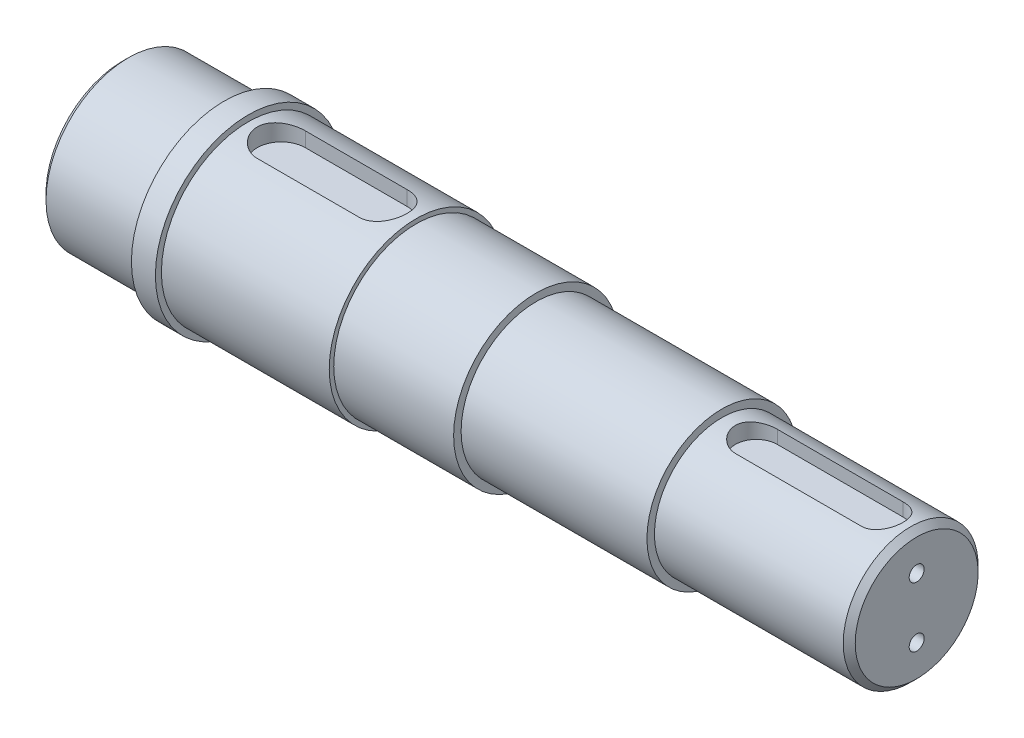
from build123d import *

# Parameters (mm, degrees)
CUT_EXTRUDE_1_DEPTH    = 6
CUT_EXTRUDE_2_DEPTH    = 5.5
CHAMFER_1_SIZE         = 2
HOLE_WIZARD_M6_1_D     = 5
HOLE_WIZARD_M6_1_DEPTH = 17
HOLE_WIZARD_M6_1_TIP   = 1.502151548


with BuildPart() as part:
    # 草图1 → 旋转1 (revolve)
    with BuildSketch(Plane.XY, mode=Mode.PRIVATE) as revolve_1_sk:
        Polygon((-76.99110035, 0), (188.00889965, 0), (188.00889965, 22.5), (123.00889965, 22.5), (123.00889965, 25), (61.00889965, 25), (61.00889965, 27.5), (21.00889965, 27.5), (21.00889965, 29), (-34.99110035, 29), (-34.99110035, 31), (-42.99110035, 31), (-42.99110035, 27.5), (-76.99110035, 27.5), align=None)
    revolve(revolve_1_sk.sketch.rotate(Axis((-104.076979444, 0, 0), (1, 0, 0)), 90), axis=Axis((-104.076979444, 0, 0), (1, 0, 0)))

    # 草图2 → 切除-拉伸1 (cut)
    with BuildSketch(Plane(origin=(0, 29, 0), x_dir=(-1, 0, 0), z_dir=(0, 1, 0))):
        with BuildLine():
            Line((23.99110035, -8), (-10.00889965, -8))
            ThreePointArc((-10.00889965, -8), (-18.00889965, 0), (-10.00889965, 8))
            Line((-10.00889965, 8), (23.99110035, 8))
            ThreePointArc((23.99110035, 8), (31.99110035, 0), (23.99110035, -8))
        make_face()
    extrude(amount=-CUT_EXTRUDE_1_DEPTH, mode=Mode.SUBTRACT)

    # 草图3 → 切除-拉伸2 (cut)
    with BuildSketch(Plane(origin=(0, 22.5, 0), x_dir=(-1, 0, 0), z_dir=(0, 1, 0))):
        with BuildLine():
            Line((-176.50889965, 7), (-134.50889965, 7))
            ThreePointArc((-134.50889965, 7), (-129.559152182, 4.949747468), (-127.50889965, 0))
            ThreePointArc((-127.50889965, 0), (-129.559152182, -4.949747468), (-134.50889965, -7))
            Line((-134.50889965, -7), (-176.50889965, -7))
            ThreePointArc((-176.50889965, -7), (-181.458647118, -4.949747468), (-183.50889965, 0))
            ThreePointArc((-183.50889965, 0), (-181.458647118, 4.949747468), (-176.50889965, 7))
        make_face()
    extrude(amount=-CUT_EXTRUDE_2_DEPTH, mode=Mode.SUBTRACT)

    # 倒角1
    chamfer_1_edges = [part.edges().sort_by_distance(p)[0] for p in [
        (188.00889965, 0, -22.5),
        (-76.99110035, 0, -27.5),
    ]]
    chamfer(chamfer_1_edges, length=CHAMFER_1_SIZE)

    # M6 螺纹孔1
    with Locations(Plane(origin=(188.00889965, 0, 0), x_dir=(0, 0, -1), z_dir=(1, 0, 0))):
        with Locations((0, 10), (0, -10)):
            Hole(HOLE_WIZARD_M6_1_D / 2, depth=HOLE_WIZARD_M6_1_DEPTH)
            with Locations((0, 0, -(HOLE_WIZARD_M6_1_DEPTH + HOLE_WIZARD_M6_1_TIP / 2))):  # 118° drill point
                Cone(0, HOLE_WIZARD_M6_1_D / 2, HOLE_WIZARD_M6_1_TIP, mode=Mode.SUBTRACT)


solid = part.part
